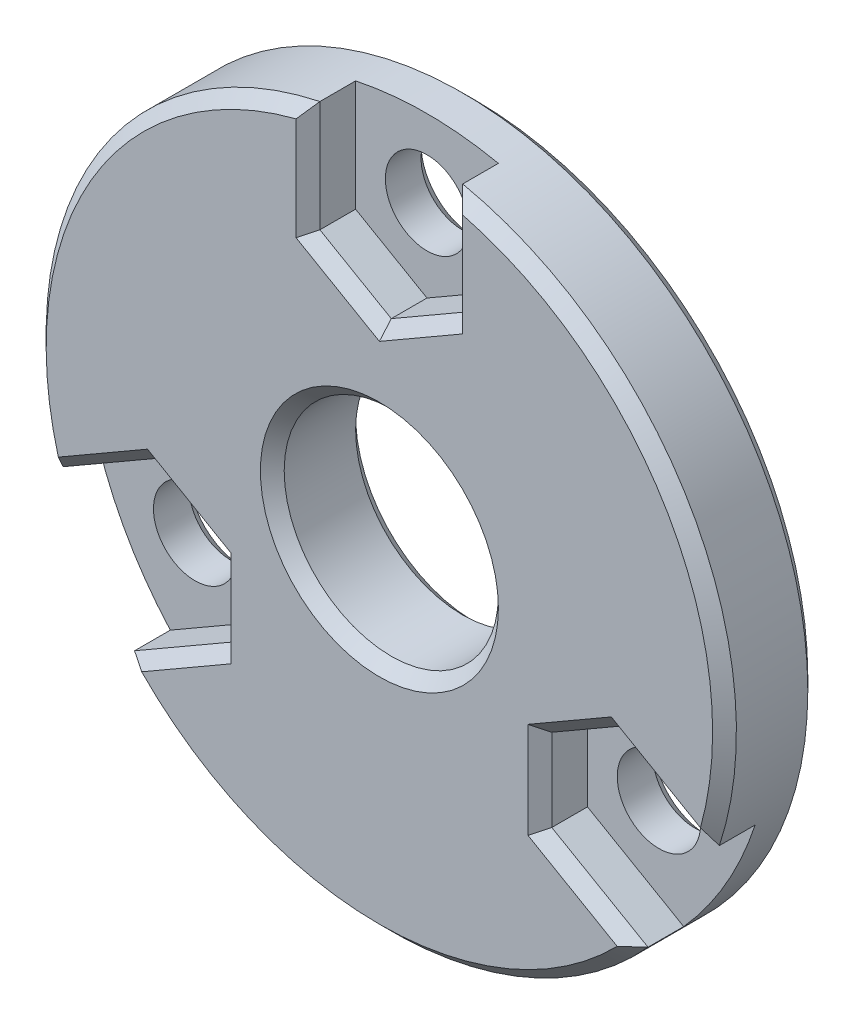
from build123d import *

# Parameters (mm, degrees)
SKETCH4_R           = 14.5
SKETCH4_R_2         = 1.75
SKETCH4_R_3         = 4.5
BOSS_EXTRUDE5_DEPTH = 4
CUT_EXTRUDE1_DEPTH  = 2
CHAMFER1_SIZE       = 0.5


with BuildPart() as part:
    # Sketch4 → Boss-Extrude5 (new body)
    with BuildSketch(Plane.XY):
        Circle(SKETCH4_R)
        with Locations((0, 11.25)):
            Circle(SKETCH4_R_2, mode=Mode.SUBTRACT)
        with Locations((9.742785793, -5.625)):
            Circle(SKETCH4_R_2, mode=Mode.SUBTRACT)
        with Locations((-9.742785793, -5.625)):
            Circle(SKETCH4_R_2, mode=Mode.SUBTRACT)
        Circle(SKETCH4_R_3, mode=Mode.SUBTRACT)
    extrude(amount=BOSS_EXTRUDE5_DEPTH)

    # Sketch5 → Cut-Extrude1 (cut)
    with BuildSketch(Plane.XY.offset(4)):
        Polygon((12.742785793, -3.892949192), (9.742785793, -2.160898385), (6.742785793, -3.892949192), (6.742785793, -7.357050808), (9.742785793, -9.089101615), (11.4748366, -10.089101615), (14.4748366, -4.892949192), align=None)
        Polygon((-3, 12.982050808), (-3, 9.517949192), (0, 7.785898385), (3, 9.517949192), (3, 12.982050808), (3, 14.982050808), (-3, 14.982050808), align=None)
        Polygon((-9.742785793, -9.089101615), (-6.742785793, -7.357050808), (-6.742785793, -3.892949192), (-9.742785793, -2.160898385), (-12.742785793, -3.892949192), (-14.4748366, -4.892949192), (-11.4748366, -10.089101615), align=None)
    extrude(amount=-CUT_EXTRUDE1_DEPTH, mode=Mode.SUBTRACT)

    # Chamfer1
    chamfer1_edges = [part.edges().sort_by_distance(p)[0] for p in [
        (-11.492785793, -5.625, 0),
        (-4.5, 0, 0),
        (-4.5, 0, 4),
        (-14.5, 0, 0),
        (-12.557368355, 7.25, 4),
        (3, 11.852105076, 4),
        (-3, 11.852105076, 4),
        (-1.5, 8.651923789, 4),
        (1.5, 8.651923789, 4),
        (11.263880326, 9.130991184, 4),
        (-1.75, 11.25, 0),
        (8.764224084, -8.524128749, 4),
        (11.764224084, -3.327976327, 4),
        (8.242785793, -3.026923789, 4),
        (6.742785793, -5.625, 4),
        (0, -14.5, 4),
        (-11.764224084, -3.327976327, 4),
        (-8.764224084, -8.524128749, 4),
        (-6.742785793, -5.625, 4),
        (-8.242785793, -3.026923789, 4),
        (7.992785793, -5.625, 0),
    ]]
    chamfer(chamfer1_edges, length=CHAMFER1_SIZE)


solid = part.part
